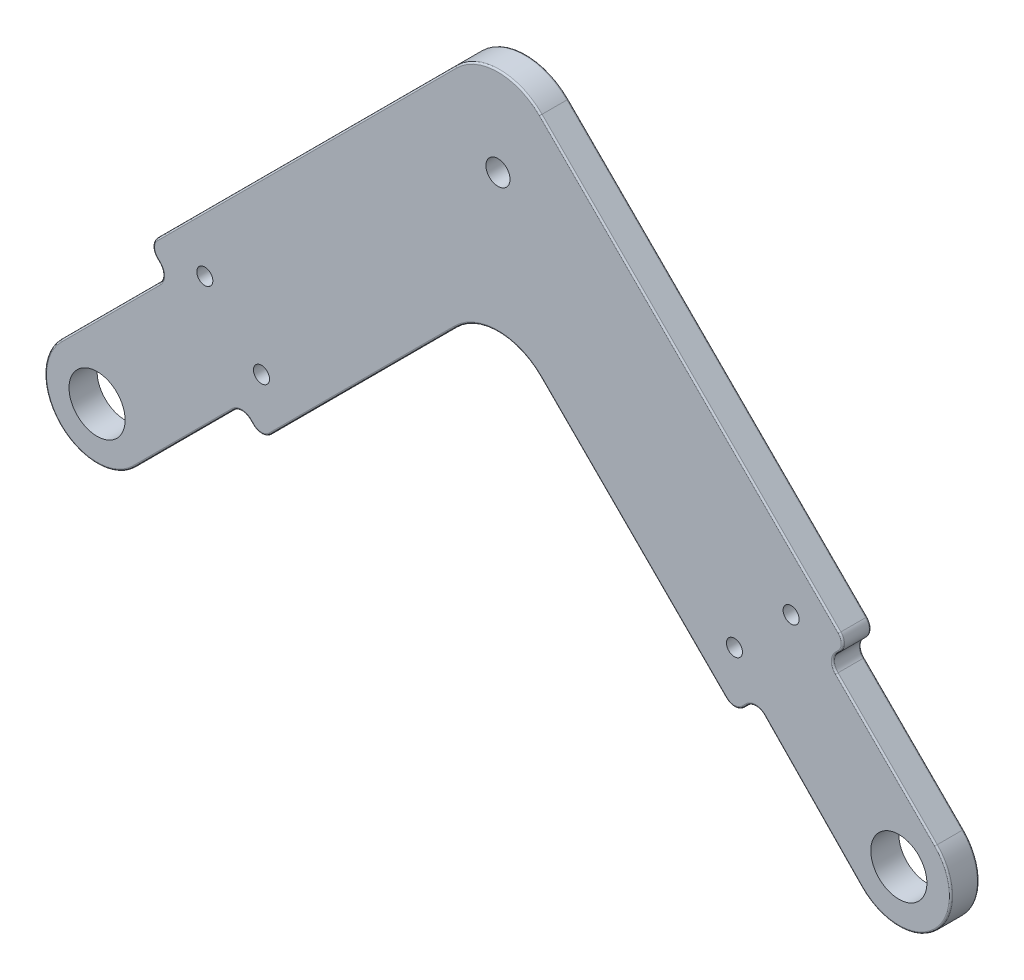
from build123d import *

# Parameters (mm, degrees)
SKETCH5_R           = 3.5
SKETCH5_R_2         = 1
SKETCH5_R_3         = 1.5
BOSS_EXTRUDE1_DEPTH = 3.5
FILLET1_R           = 7.5
FILLET2_R           = 1.5
FILLET3_R           = 0.2


with BuildPart() as part:
    # Sketch5 → Boss-Extrude1 (new body)
    with BuildSketch(Plane.XY):
        with BuildLine():
            Line((-91.161165235, 18.03122292), (-104.596194078, 4.596194078))
            ThreePointArc((-104.596194078, 4.596194078), (-104.596194078, -4.596194078), (-95.403805922, -4.596194078))
            Line((-95.403805922, -4.596194078), (-81.96877708, 8.838834765))
            Line((-81.96877708, 8.838834765), (-79.493903346, 6.363961031))
            Line((-79.493903346, 6.363961031), (-50, 35.857864376))
            Line((-50, 35.857864376), (-20.506096654, 6.363961031))
            Line((-20.506096654, 6.363961031), (-17.850909276, 9.019148409))
            Line((-17.850909276, 9.019148409), (-4.657601188, -4.533955357))
            ThreePointArc((-4.657601188, -4.533955357), (4.565177968, -4.627002282), (4.596194078, 4.596194078))
            Line((4.596194078, 4.596194078), (-8.838834765, 18.03122292))
            Line((-8.838834765, 18.03122292), (-6.363961031, 20.506096654))
            Line((-6.363961031, 20.506096654), (-50, 64.142135624))
            Line((-50, 64.142135624), (-93.636038969, 20.506096654))
            Line((-93.636038969, 20.506096654), (-91.161165235, 18.03122292))
        make_face()
        Circle(SKETCH5_R, mode=Mode.SUBTRACT)
        with Locations((-100, 0)):
            Circle(SKETCH5_R, mode=Mode.SUBTRACT)
        with Locations((-79.493903346, 13.435028843)):
            Circle(SKETCH5_R_2, mode=Mode.SUBTRACT)
        with Locations((-86.564971157, 20.506096654)):
            Circle(SKETCH5_R_2, mode=Mode.SUBTRACT)
        with Locations((-13.435028843, 20.506096654)):
            Circle(SKETCH5_R_2, mode=Mode.SUBTRACT)
        with Locations((-20.506096654, 13.435028843)):
            Circle(SKETCH5_R_2, mode=Mode.SUBTRACT)
        with Locations((-50, 50)):
            Circle(SKETCH5_R_3, mode=Mode.SUBTRACT)
    extrude(amount=BOSS_EXTRUDE1_DEPTH)

    # Fillet1
    fillet1_edges = [part.edges().sort_by_distance(p)[0] for p in [
        (-50, 64.142135624, 1.75),
        (-50, 35.857864376, 1.75),
    ]]
    fillet(fillet1_edges, radius=FILLET1_R)

    # Fillet2
    fillet2_edges = [part.edges().sort_by_distance(p)[0] for p in [
        (-81.96877708, 8.838834765, 1.75),
        (-91.161165235, 18.03122292, 1.75),
        (-93.636038969, 20.506096654, 1.75),
        (-6.363961031, 20.506096654, 1.75),
        (-8.838834765, 18.03122292, 1.75),
        (-17.850909276, 9.019148409, 1.75),
        (-20.506096654, 6.363961031, 1.75),
        (-79.493903346, 6.363961031, 1.75),
    ]]
    fillet(fillet2_edges, radius=FILLET2_R)

    # Fillet3
    fillet3_edges = [part.edges().sort_by_distance(p)[0] for p in [
        (-93.014718626, 20.506096654, 3.5),
        (-20.506096654, 6.985281374, 3.5),
        (-6.985281374, 20.506096654, 3.5),
        (-8.217514421, 18.03122292, 0),
        (-8.217514421, 18.03122292, 3.5),
        (-17.855184959, 8.383430059, 0),
        (-17.855184959, 8.383430059, 3.5),
        (-91.782485579, 18.03122292, 0),
        (-91.782485579, 18.03122292, 3.5),
        (-81.96877708, 8.217514421, 0),
        (-81.96877708, 8.217514421, 3.5),
        (-89.216621587, 1.590990258, 0),
        (-104.596194078, -4.596194078, 0),
        (-1.590990258, 10.783378413, 0),
        (4.565177968, -4.627002282, 0),
        (4.565177968, -4.627002282, 3.5),
        (-1.590990258, 10.783378413, 3.5),
        (-104.596194078, -4.596194078, 3.5),
        (-89.216621587, 1.590990258, 3.5),
        (-33.131727984, 18.98959236, 0),
        (-33.131727984, 18.98959236, 3.5),
        (-73.939339828, 40.202795796, 0),
        (-73.939339828, 40.202795796, 3.5),
        (-50, 61.035533906, 0),
        (-50, 61.035533906, 3.5),
        (-50, 32.751262658, 0),
        (-50, 32.751262658, 3.5),
        (-7.601397898, 19.268659787, 0),
        (-7.601397898, 19.268659787, 3.5),
        (-26.060660172, 40.202795796, 0),
        (-26.060660172, 40.202795796, 3.5),
        (-10.724021751, 1.697903009, 0),
        (-19.185685006, 7.684372679, 0),
        (-66.868272016, 18.98959236, 0),
        (-80.731340213, 7.601397898, 0),
        (-98.409009742, 10.783378413, 0),
        (-92.398602102, 19.268659787, 0),
        (-79.493903346, 6.985281374, 0),
        (-93.014718626, 20.506096654, 0),
        (-20.506096654, 6.985281374, 0),
        (-6.985281374, 20.506096654, 0),
        (-92.398602102, 19.268659787, 3.5),
        (-98.409009742, 10.783378413, 3.5),
        (-80.731340213, 7.601397898, 3.5),
        (-66.868272016, 18.98959236, 3.5),
        (-19.185685006, 7.684372679, 3.5),
        (-10.724021751, 1.697903009, 3.5),
        (-79.493903346, 6.985281374, 3.5),
    ]]
    fillet(fillet3_edges, radius=FILLET3_R)


solid = part.part
